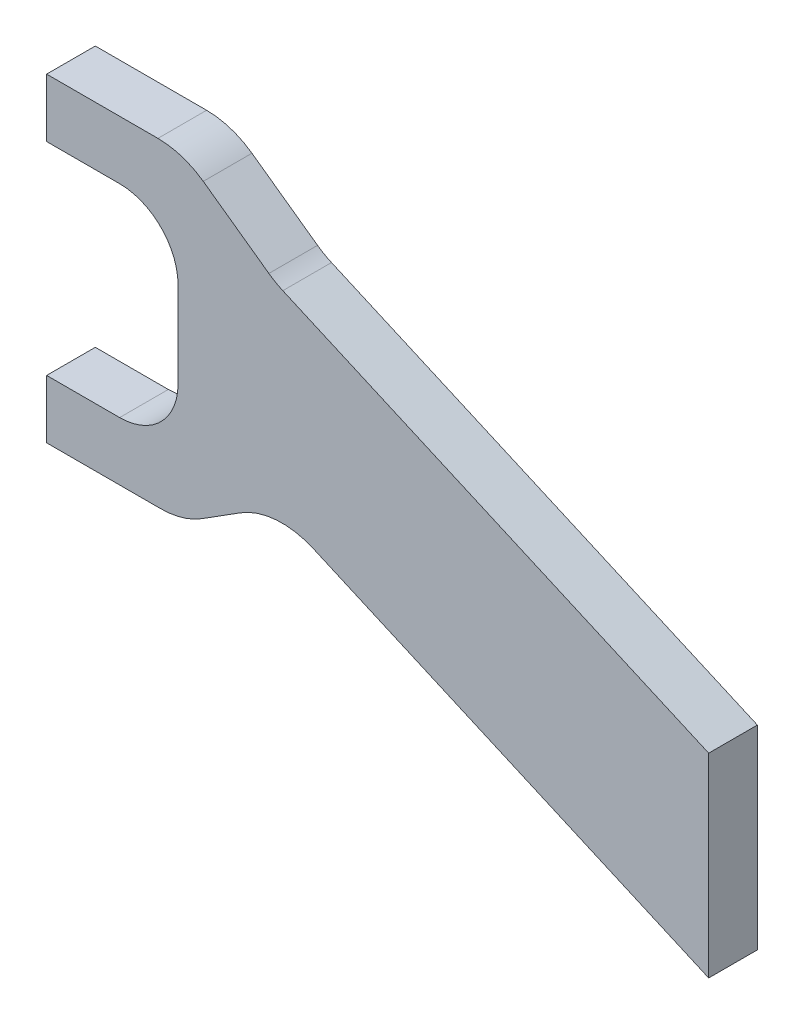
from build123d import *

# Parameters (mm, degrees)
BOSS_EXTRUDE1_DEPTH = 0.125
FILLET1_R           = 0.3
FILLET2_R           = 0.4


with BuildPart() as part:
    # frame_outline → Boss-Extrude1 (new, symmetric)
    with BuildSketch(Plane.XY):
        Polygon((0, 1.64), (0, 1.34), (0.675, 1.34), (0.675, 0.3), (0, 0.3), (0, 0), (0.7, 0), (1.175, 0.3), (3.4, -0.68), (3.4, 0.32), (1.175, 1.3), (0.7, 1.64), align=None)
    extrude(amount=BOSS_EXTRUDE1_DEPTH, both=True)

    # Fillet1
    fillet1_edges = [part.edges().sort_by_distance(p)[0] for p in [
        (0.675, 0.3, 0),
        (0.675, 1.34, 0),
    ]]
    fillet(fillet1_edges, radius=FILLET1_R)

    # Fillet2
    fillet2_edges = [part.edges().sort_by_distance(p)[0] for p in [
        (0.7, 1.64, 0),
        (1.175, 1.3, 0),
        (1.175, 0.3, 0),
        (0.7, 0, 0),
    ]]
    fillet(fillet2_edges, radius=FILLET2_R)


solid = part.part
